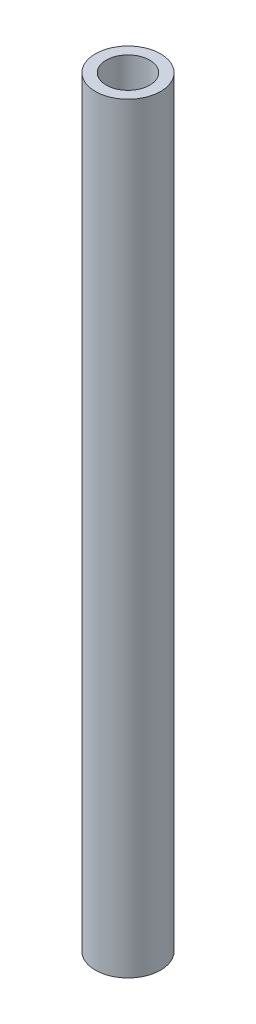
from build123d import *

# Parameters (mm, degrees)
SKETCH_1_R      = 3
SKETCH_1_R_2    = 2
EXTRUDE_1_DEPTH = 70


with BuildPart() as part:
    # Эскиз1 → Бобышка-Вытянуть1 (new body)
    with BuildSketch(Plane(origin=(0, 0, 0), x_dir=(1, 0, 0), z_dir=(0, 1, 0))):
        Circle(SKETCH_1_R)
        Circle(SKETCH_1_R_2, mode=Mode.SUBTRACT)
    extrude(amount=EXTRUDE_1_DEPTH)


solid = part.part
